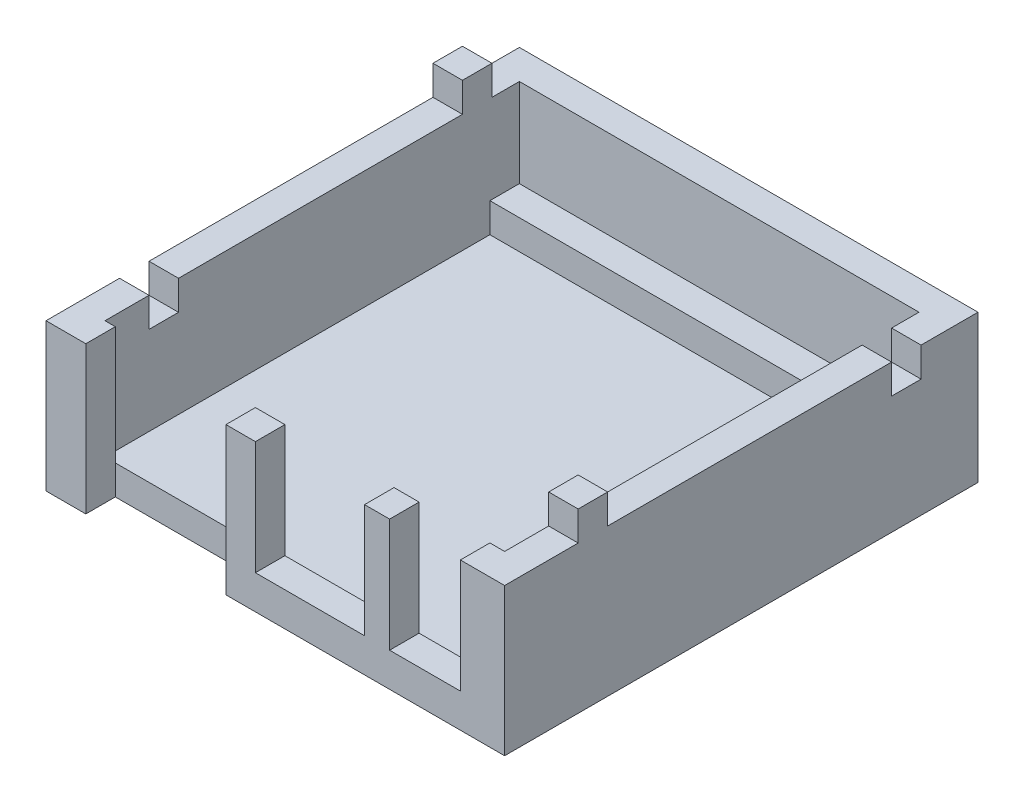
from build123d import *

# Parameters (mm, degrees)
SKETCH3_W            = 31.1
SKETCH3_H            = 32.1
SHELL_DEPTH          = 10
SKETCH4_W            = 27.1
SKETCH4_H            = 26.1
MAIN_CAVITY_DEPTH    = 8
SKETCH5_W            = 27.1
SKETCH5_H            = 2
SUPPORT_SHELF_DEPTH  = 6
SKETCH6_W            = 4.8
SKETCH6_H            = 7.7
SKETCH6_W_2          = 7.4
SKETCH6_W_3          = 9.5
SKETCH6_H_2          = 10
TERMINAL_INPUT_DEPTH = 2
SKETCH7_W            = 2
SKETCH7_H            = 2
MALE_TABS_DEPTH      = 2
SKETCH8_W            = 2
SKETCH8_H            = 2
CUT_EXTRUDE4_DEPTH   = 2


with BuildPart() as part:
    # Sketch3 → Shell (new body)
    with BuildSketch(Plane(origin=(0, 0, 0), x_dir=(1, 0, 0), z_dir=(0, 1, 0))):
        with Locations((15.55, -16.05)):
            Rectangle(SKETCH3_W, SKETCH3_H)
    extrude(amount=SHELL_DEPTH)

    # Sketch4 → Main Cavity (cut)
    with BuildSketch(Plane(origin=(0, 10, 0), x_dir=(1, 0, 0), z_dir=(0, 1, 0))):
        with Locations((15.55, -17.05)):
            Rectangle(SKETCH4_W, SKETCH4_H)
    extrude(amount=-MAIN_CAVITY_DEPTH, mode=Mode.SUBTRACT)

    # Sketch5 → Support Shelf (cut)
    with BuildSketch(Plane(origin=(0, 10, 0), x_dir=(1, 0, 0), z_dir=(0, 1, 0))):
        with Locations((15.55, -3)):
            Rectangle(SKETCH5_W, SKETCH5_H)
    extrude(amount=-SUPPORT_SHELF_DEPTH, mode=Mode.SUBTRACT)

    # Sketch6 → Terminal Input (cut)
    with BuildSketch(Plane.XY.offset(32.1)):
        with Locations((25.7, 6.15)):
            Rectangle(SKETCH6_W, SKETCH6_H)
        with Locations((17.9, 6.15)):
            Rectangle(SKETCH6_W_2, SKETCH6_H)
        with Locations((7.45, 5)):
            Rectangle(SKETCH6_W_3, SKETCH6_H_2)
    extrude(amount=-TERMINAL_INPUT_DEPTH, mode=Mode.SUBTRACT)

    # Sketch7 → Male Tabs (add)
    with BuildSketch(Plane(origin=(0, 10, 0), x_dir=(1, 0, 0), z_dir=(0, 1, 0))):
        with Locations((30.1, -26.112988121)):
            Rectangle(SKETCH7_W, SKETCH7_H)
        with Locations((1, -4.859742299)):
            Rectangle(SKETCH7_W, SKETCH7_H)
    extrude(amount=MALE_TABS_DEPTH)

    # Sketch8 → Cut-Extrude4 (cut)
    with BuildSketch(Plane(origin=(0, 10, 0), x_dir=(1, 0, 0), z_dir=(0, 1, 0))):
        with Locations((30.1, -4.859742299)):
            Rectangle(SKETCH8_W, SKETCH8_H)
        with Locations((1, -26.112988121)):
            Rectangle(SKETCH8_W, SKETCH8_H)
    extrude(amount=-CUT_EXTRUDE4_DEPTH, mode=Mode.SUBTRACT)


solid = part.part
